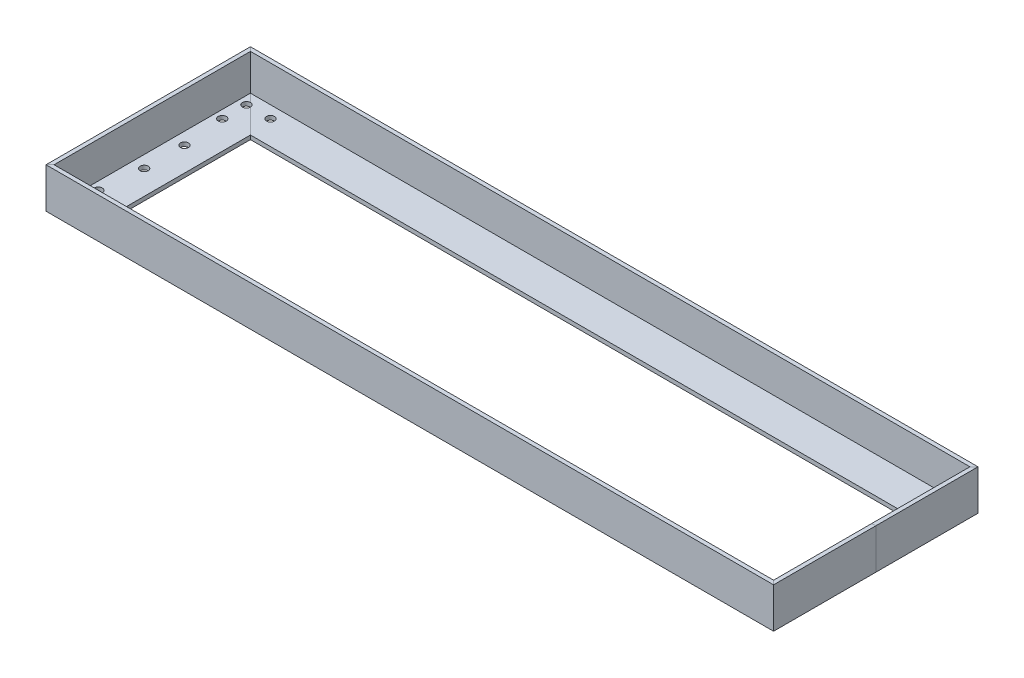
from build123d import *

# Parameters (mm, degrees)
CUT_EXTRUDE1_DEPTH      = 472.899618563
CUT_EXTRUDE1_DEPTH_BACK = 472.899618563
SKETCH5_R               = 5


with BuildPart() as part:
    # Sweep3: sweep along a path in Sketch1
    with BuildLine(Plane(origin=(0, 0, 0), x_dir=(1, 0, 0), z_dir=(0, 1, 0))) as sweep3_path:
        Line((-450, -125), (450, -125))
        Line((450, -125), (450, 125))
        Line((450, 125), (-450, 125))
        Line((-450, 125), (-450, -125))
    # Sketch2 → Sweep3 (sweep)
    with BuildSketch(Plane.XY):
        Polygon((402, -2.5), (452, -2.5), (452, 47.5), (447, 47.5), (447, 2.5), (402, 2.5), align=None)
    sweep(path=sweep3_path.line, transition=Transition.RIGHT)

    # Sketch5 → Cut-Extrude1 (cut, two sides: drawn at the far end of the back side and taken through both)
    with BuildSketch(Plane(origin=(0, 0, 0), x_dir=(1, 0, 0), z_dir=(0, 1, 0)).offset(-CUT_EXTRUDE1_DEPTH_BACK)):
        with Locations((-437, 107)):
            Circle(SKETCH5_R)
        with Locations(Location((-407, 107, 0), (0, 0, 270))):
            Circle(SKETCH5_R)
        with Locations(Location((-432, 25, 0), (0, 0, 270))):
            Circle(SKETCH5_R)
        with Locations(Location((-437, 77, 0), (0, 0, 270))):
            Circle(SKETCH5_R)
        with Locations(Location((-407, -107, 0), (0, 0, 270))):
            Circle(SKETCH5_R)
        with Locations(Location((-437, -107, 0), (0, 0, 270))):
            Circle(SKETCH5_R)
        with Locations(Location((-437, -77, 0), (0, 0, 180))):
            Circle(SKETCH5_R)
        with Locations(Location((-432, -25, 0), (0, 0, 180))):
            Circle(SKETCH5_R)
        with Locations(Location((432, -25, 0), (0, 0, 270))):
            Circle(SKETCH5_R)
        with Locations(Location((437, -77, 0), (0, 0, 270))):
            Circle(SKETCH5_R)
        with Locations(Location((437, -107, 0), (0, 0, 270))):
            Circle(SKETCH5_R)
        with Locations(Location((407, -107, 0), (0, 0, 270))):
            Circle(SKETCH5_R)
        with Locations(Location((437, 77, 0), (0, 0, 180))):
            Circle(SKETCH5_R)
        with Locations(Location((432, 25, 0), (0, 0, 180))):
            Circle(SKETCH5_R)
        with Locations(Location((407, 107, 0), (0, 0, 270))):
            Circle(SKETCH5_R)
        with Locations(Location((437, 107, 0), (0, 0, 180))):
            Circle(SKETCH5_R)
    extrude(amount=CUT_EXTRUDE1_DEPTH + CUT_EXTRUDE1_DEPTH_BACK, mode=Mode.SUBTRACT)


solid = part.part
